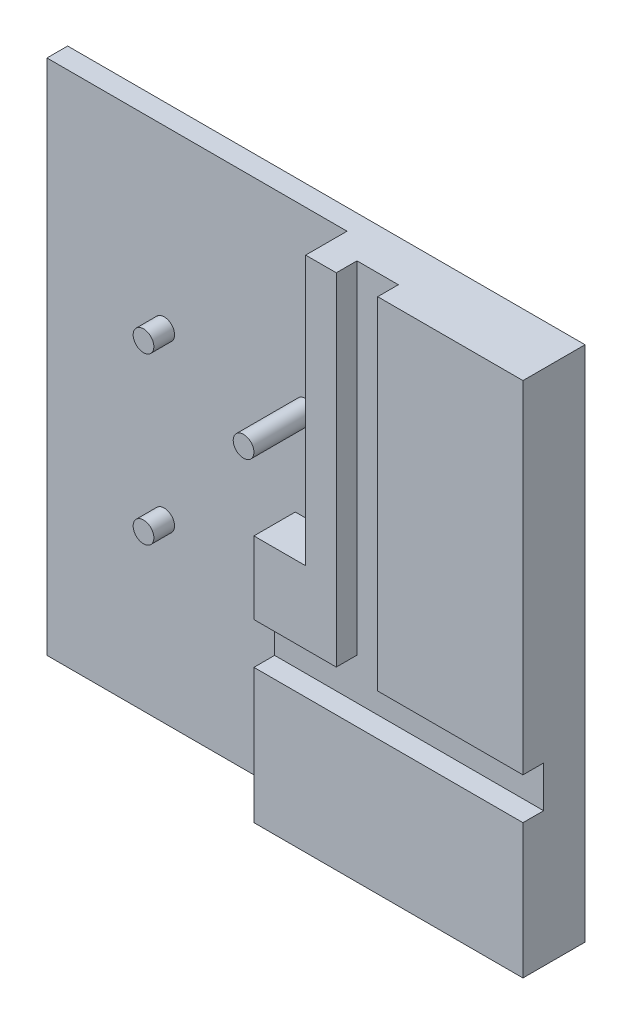
from build123d import *

# Parameters (mm, degrees)
SKETCH_1_W          = 250
SKETCH_1_H          = 250
EXTRUDE_1_DEPTH     = 10
SKETCH_2_R          = 5
EXTRUDE_2_DEPTH     = 10
SKETCH_3_R          = 5
EXTRUDE_3_DEPTH     = 30
SKETCH_4_W          = 14.8
SKETCH_4_H          = 165
EXTRUDE_4_DEPTH     = 20
SKETCH_5_W          = 100
SKETCH_5_H          = 65
EXTRUDE_5_DEPTH     = 20
SKETCH_6_W          = 100
SKETCH_6_H          = 250
EXTRUDE_6_DEPTH     = 10
SKETCH_7_W          = 70.2
SKETCH_7_H          = 165
EXTRUDE_7_DEPTH     = 10
SKETCH_8_W          = 30
SKETCH_8_H          = 120
EXTRUDE_8_DEPTH     = 20
SKETCH_9_W          = 30
SKETCH_9_H          = 20
CUT_EXTRUDE_1_DEPTH = 10


with BuildPart() as part:
    # 草图1 → 凸台-拉伸1 (new body)
    with BuildSketch(Plane.XY):
        Rectangle(SKETCH_1_W, SKETCH_1_H)
    extrude(amount=-EXTRUDE_1_DEPTH)

    # 草图2 → 凸台-拉伸2 (add)
    with BuildSketch(Plane.XY):
        with Locations((-68.35, 40)):
            Circle(SKETCH_2_R)
    extrude_2 = extrude(amount=EXTRUDE_2_DEPTH)

    # 镜向1: 凸台-拉伸2 across plane
    add(extrude_2.mirror(Plane.ZX))

    # 草图3 → 凸台-拉伸3 (add)
    with BuildSketch(Plane.XY):
        with Locations((0, 40)):
            Circle(SKETCH_3_R)
    extrude(amount=EXTRUDE_3_DEPTH)

    # 草图4 → 凸台-拉伸4 (add)
    with BuildSketch(Plane.XY):
        with Locations((27.4, 42.5)):
            Rectangle(SKETCH_4_W, SKETCH_4_H)
    extrude(amount=EXTRUDE_4_DEPTH)

    # 草图5 → 凸台-拉伸5 (add)
    with BuildSketch(Plane.XY):
        with Locations((75, -92.5)):
            Rectangle(SKETCH_5_W, SKETCH_5_H)
    extrude(amount=EXTRUDE_5_DEPTH)

    # 草图6 → 凸台-拉伸6 (add)
    with BuildSketch(Plane.XY):
        with Locations((75, 0)):
            Rectangle(SKETCH_6_W, SKETCH_6_H)
    extrude(amount=EXTRUDE_6_DEPTH)

    # 草图7 → 凸台-拉伸7 (add)
    with BuildSketch(Plane.XY.offset(10)):
        with Locations((89.9, 42.5)):
            Rectangle(SKETCH_7_W, SKETCH_7_H)
    extrude(amount=EXTRUDE_7_DEPTH)

    # 草图8 → 凸台-拉伸8 (add)
    with BuildSketch(Plane.XY):
        with Locations((10, -65)):
            Rectangle(SKETCH_8_W, SKETCH_8_H)
    extrude(amount=EXTRUDE_8_DEPTH)

    # 草图9 → 切除-拉伸1 (cut)
    with BuildSketch(Plane.XY.offset(20)):
        with Locations((10, -50)):
            Rectangle(SKETCH_9_W, SKETCH_9_H)
    extrude(amount=-CUT_EXTRUDE_1_DEPTH, mode=Mode.SUBTRACT)


solid = part.part
